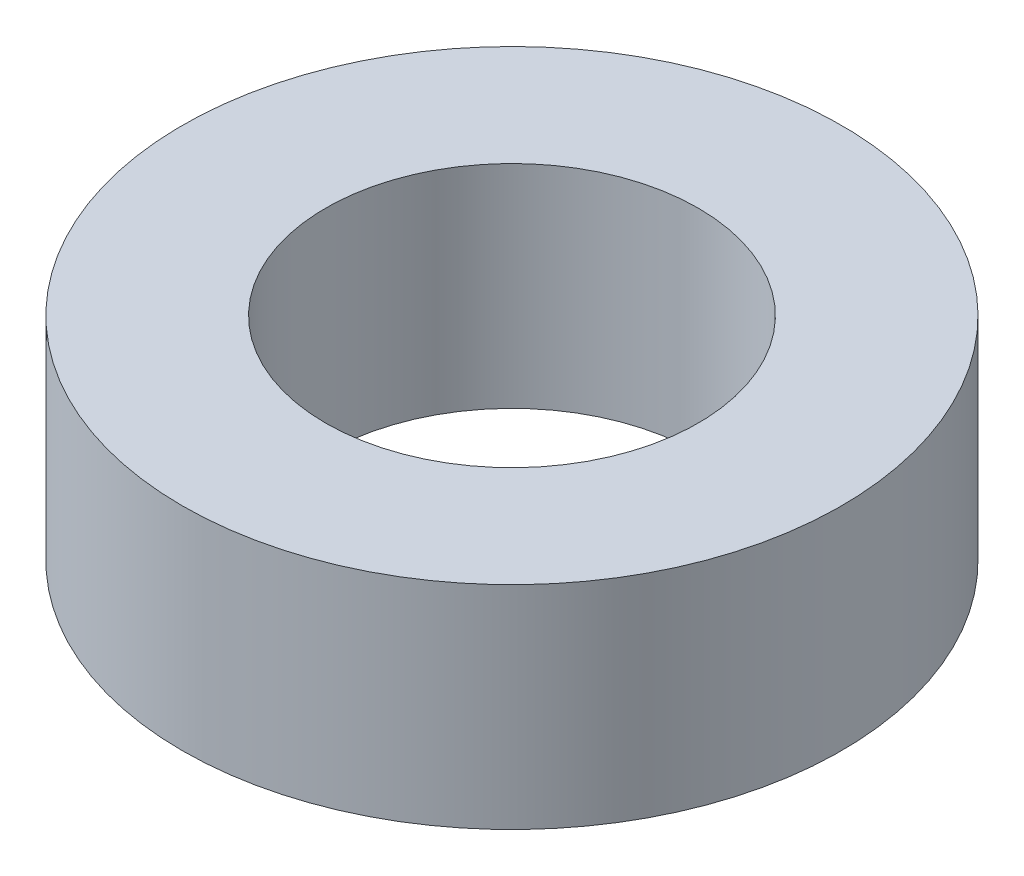
from build123d import *

# Parameters (mm, degrees)
SKETCH_1_R      = 9.2
SKETCH_1_R_2    = 5.2
EXTRUDE_1_DEPTH = 5.92


with BuildPart() as part:
    # 草图1 → 凸台-拉伸1 (new body)
    with BuildSketch(Plane(origin=(0, 0, 0), x_dir=(1, 0, 0), z_dir=(0, 1, 0))):
        with Locations(Location((0, 0, 0), (0, 0, 270))):
            Circle(SKETCH_1_R)
        with Locations(Location((0, 0, 0), (0, 0, 270))):
            Circle(SKETCH_1_R_2, mode=Mode.SUBTRACT)
    extrude(amount=EXTRUDE_1_DEPTH)


solid = part.part
